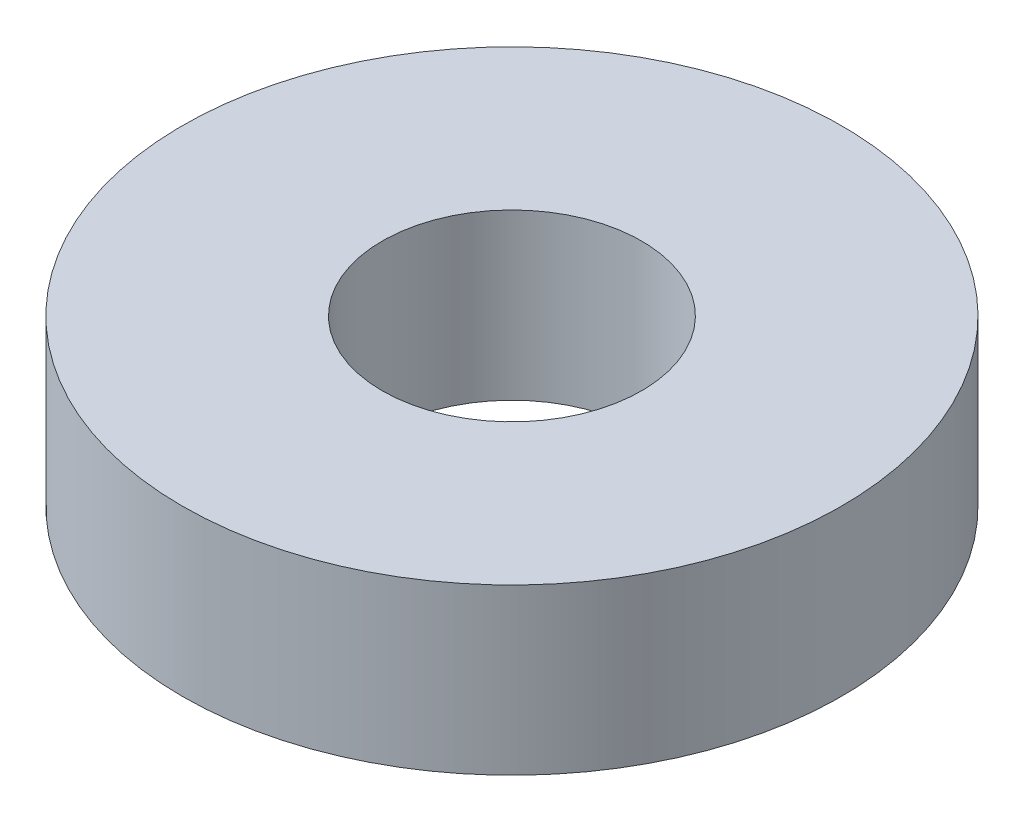
from build123d import *

# Parameters (mm, degrees)
SKETCH1_R       = 6.35
WHEELBASE_DEPTH = 1.5875
SKETCH3_R       = 2.5
CIRCLEFIT_DEPTH = 10.525


with BuildPart() as part:
    # Sketch1 → wheelbase (new, symmetric)
    with BuildSketch(Plane(origin=(0, 0, 0), x_dir=(1, 0, 0), z_dir=(0, 1, 0))):
        Circle(SKETCH1_R)
    extrude(amount=WHEELBASE_DEPTH, both=True)

    # Sketch3 → circlefit (cut, through all)
    with BuildSketch(Plane(origin=(0, 1.5875, 0), x_dir=(1, 0, 0), z_dir=(0, 1, 0))):
        Circle(SKETCH3_R)
    extrude(amount=-CIRCLEFIT_DEPTH, mode=Mode.SUBTRACT)


solid = part.part
